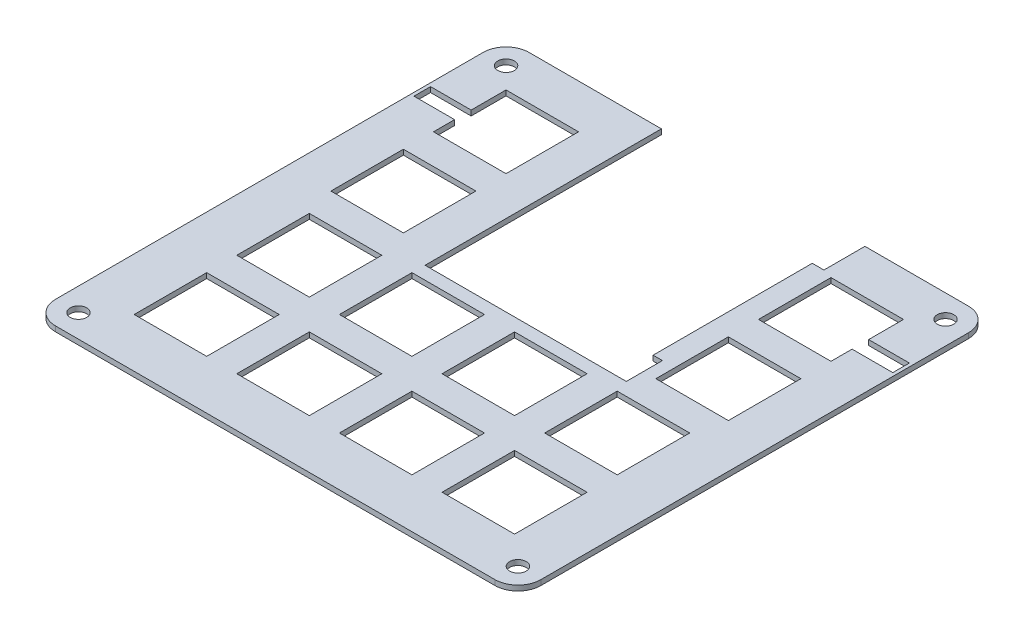
from build123d import *

# Parameters (mm, degrees)
SKETCH2_R           = 1.6
BOSS_EXTRUDE3_DEPTH = 1


with BuildPart() as part:
    # Sketch2 → Boss-Extrude3 (new body)
    with BuildSketch(Plane(origin=(0, 0, 0), x_dir=(1, 0, 0), z_dir=(0, 1, 0))):
        with BuildLine():
            Line((-46.858540632, 41.275), (-46.858540632, -41.275))
            ThreePointArc((-46.858540632, -41.275), (-45.557936393, -44.414936393), (-42.418, -45.715540632))
            Line((-42.418, -45.715540632), (42.418, -45.715540632))
            ThreePointArc((42.418, -45.715540632), (45.557936393, -44.414936393), (46.858540632, -41.275))
            Line((46.858540632, -41.275), (46.858540632, 41.275))
            ThreePointArc((46.858540632, 41.275), (45.557936393, 44.414936393), (42.418, 45.715540632))
            Line((42.418, 45.715540632), (22.418, 45.715540632))
            Line((22.418, 45.715540632), (22.418, 41.275))
            Line((22.418, 41.275), (22.418, 39.575))
            Line((22.418, 39.575), (22.418, 37.797317828))
            Line((22.418, 37.797317828), (20.16872062, 37.797317828))
            Line((20.16872062, 37.797317828), (20.16872062, 9.575))
            Line((20.16872062, 9.575), (20.16872062, 7.075))
            Line((20.16872062, 7.075), (21.96872062, 7.075))
            Line((21.96872062, 7.075), (21.96872062, 0.094907102))
            Line((21.96872062, 0.094907102), (-9.912382857, 0.094907102))
            Line((-9.912382857, 0.094907102), (-16.875382857, 0.094907102))
            Line((-16.875382857, 0.094907102), (-16.875382857, 30.218907102))
            Line((-16.875382857, 30.218907102), (-16.875382857, 45.715540632))
            Line((-16.875382857, 45.715540632), (-42.418, 45.715540632))
            ThreePointArc((-42.418, 45.715540632), (-45.557936393, 44.414936393), (-46.858540632, 41.275))
        make_face()
        with Locations(Location((-42.418, -41.275, 0), (0, 0, 270))):
            Circle(SKETCH2_R, mode=Mode.SUBTRACT)
        Polygon((-36.724382857, -36.217092898), (-36.724382857, -29.217092898), (-36.724382857, -22.217092898), (-22.724382857, -22.217092898), (-22.724382857, -36.217092898), align=None, mode=Mode.SUBTRACT)
        Polygon((-16.912382857, -22.217092898), (-9.912382857, -22.217092898), (-2.912382857, -22.217092898), (-2.912382857, -36.217092898), (-16.912382857, -36.217092898), align=None, mode=Mode.SUBTRACT)
        Polygon((-36.724382857, -16.405092898), (-36.724382857, -9.405092898), (-36.724382857, -2.405092898), (-22.724382857, -2.405092898), (-22.724382857, -16.405092898), align=None, mode=Mode.SUBTRACT)
        Polygon((-2.912382857, -16.405092898), (-9.912382857, -16.405092898), (-16.912382857, -16.405092898), (-16.912382857, -2.405092898), (-2.912382857, -2.405092898), align=None, mode=Mode.SUBTRACT)
        Polygon((2.899617143, -22.217092898), (9.899617143, -22.217092898), (16.899617143, -22.217092898), (16.899617143, -36.217092898), (2.899617143, -36.217092898), align=None, mode=Mode.SUBTRACT)
        with Locations(Location((42.418, -41.275, 0), (0, 0, 270))):
            Circle(SKETCH2_R, mode=Mode.SUBTRACT)
        Polygon((36.711617143, -22.217092898), (36.711617143, -29.217092898), (36.711617143, -36.217092898), (22.711617143, -36.217092898), (22.711617143, -22.217092898), align=None, mode=Mode.SUBTRACT)
        Polygon((2.899617143, -2.405092898), (9.899617143, -2.405092898), (16.899617143, -2.405092898), (16.899617143, -16.405092898), (2.899617143, -16.405092898), align=None, mode=Mode.SUBTRACT)
        Polygon((22.711617143, -2.405092898), (29.711617143, -2.405092898), (36.711617143, -2.405092898), (36.711617143, -16.405092898), (22.711617143, -16.405092898), align=None, mode=Mode.SUBTRACT)
        Polygon((-38.375382857, 3.406907102), (-38.375382857, 10.406907102), (-38.375382857, 17.406907102), (-24.375382857, 17.406907102), (-24.375382857, 3.406907102), align=None, mode=Mode.SUBTRACT)
        Polygon((-46.218, 27.292), (-46.218, 28.892), (-46.218, 30.492), (-38.375382857, 30.492), (-38.375382857, 37.218907102), (-31.375382857, 37.218907102), (-24.375382857, 37.218907102), (-24.375382857, 23.218907102), (-38.375382857, 23.218907102), (-38.375382857, 27.292), align=None, mode=Mode.SUBTRACT)
        with Locations(Location((-42.418, 41.275, 0), (0, 0, 270))):
            Circle(SKETCH2_R, mode=Mode.SUBTRACT)
        Polygon((38.362617143, 17.406907102), (38.362617143, 10.406907102), (38.362617143, 3.406907102), (24.362617143, 3.406907102), (24.362617143, 17.406907102), align=None, mode=Mode.SUBTRACT)
        Polygon((46.218, 27.292), (42.418, 27.292), (38.362617143, 27.292), (38.362617143, 23.218907102), (24.362617143, 23.218907102), (24.362617143, 37.218907102), (38.362617143, 37.218907102), (38.362617143, 30.492), (42.418, 30.492), (46.218, 30.492), align=None, mode=Mode.SUBTRACT)
        with Locations(Location((42.418, 41.275, 0), (0, 0, 270))):
            Circle(SKETCH2_R, mode=Mode.SUBTRACT)
    extrude(amount=BOSS_EXTRUDE3_DEPTH)


solid = part.part
